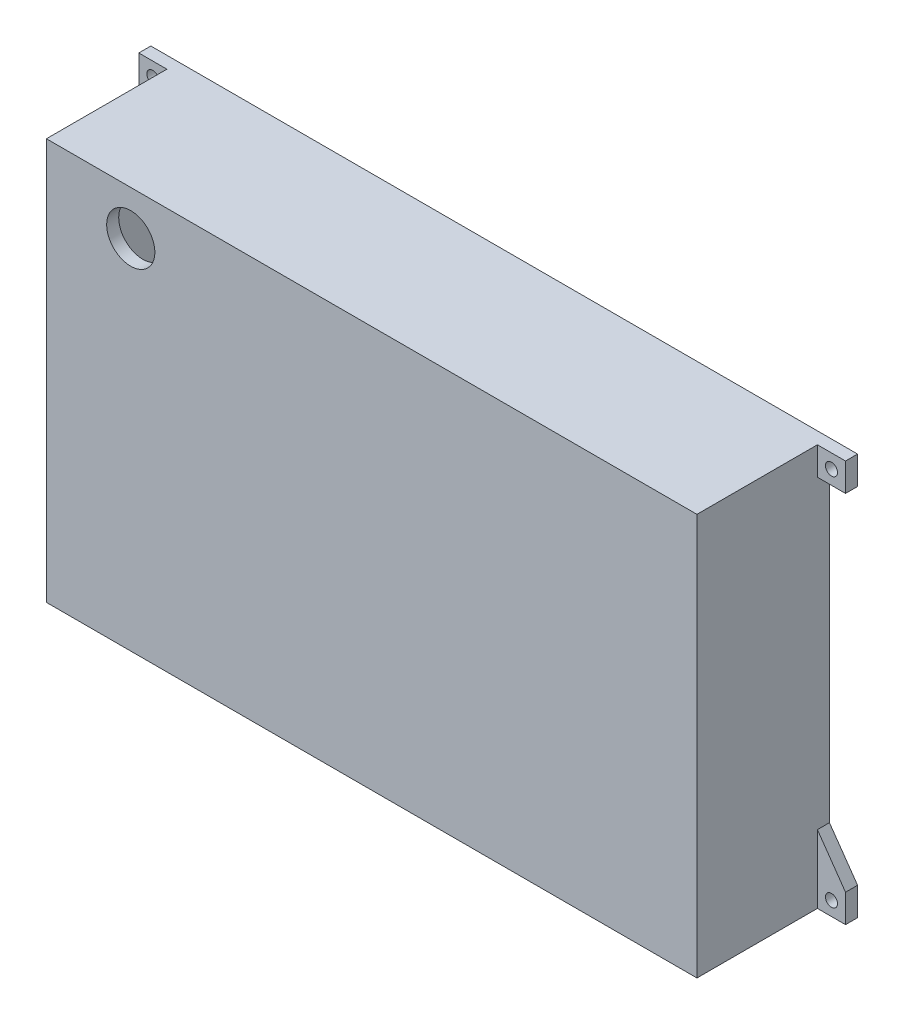
from build123d import *

# Parameters (mm, degrees)
BOSS_EXTRUDE1_DEPTH = 33
SKETCH1_4_W         = 7
SKETCH1_4_H         = 7
SKETCH1_4_R         = 1.5
BOSS_EXTRUDE2_DEPTH = 3
SKETCH3_W           = 156
SKETCH3_H           = 97
CUT_EXTRUDE1_DEPTH  = 30
SKETCH3_4_R         = 6
CUT_EXTRUDE2_DEPTH  = 33


with BuildPart() as part:
    # Sketch1 → Boss-Extrude1 (new body)
    with BuildSketch(Plane.XY):
        Polygon((162, 93), (162, 100), (0, 100), (0, 93), (0, 17), (0, 7), (0, 0), (162, 0), (162, 7), (162, 17), align=None)
    extrude(amount=BOSS_EXTRUDE1_DEPTH)

    # Sketch1<4> → Boss-Extrude2 (add)
    # profile 1 of 4: a face of its own
    with BuildSketch(Plane.XY):
        with Locations((165.5, 96.5)):
            Rectangle(SKETCH1_4_W, SKETCH1_4_H)
        with Locations((165.5, 96.5)):
            Circle(SKETCH1_4_R, mode=Mode.SUBTRACT)
    # profile 2 of 4: a face of its own
    with BuildSketch(Plane.XY):
        with Locations((-3.5, 96.5)):
            Rectangle(SKETCH1_4_W, SKETCH1_4_H)
        with Locations((-3.5, 96.5)):
            Circle(SKETCH1_4_R, mode=Mode.SUBTRACT)
    # profile 3 of 4: a face of its own
    with BuildSketch(Plane.XY):
        Polygon((169, 7), (162, 17), (162, 0), (169, 0), align=None)
        with Locations((165.5, 3.5)):
            Circle(SKETCH1_4_R, mode=Mode.SUBTRACT)
    # profile 4 of 4: a face of its own
    with BuildSketch(Plane.XY):
        Polygon((0, 0), (0, 17), (-7, 7), (-7, 0), align=None)
        with Locations((-3.5, 3.5)):
            Circle(SKETCH1_4_R, mode=Mode.SUBTRACT)
    extrude(amount=BOSS_EXTRUDE2_DEPTH)

    # Sketch3 → Cut-Extrude1 (cut)
    with BuildSketch(Plane(origin=(0, 0, 0), x_dir=(-1, 0, 0), z_dir=(0, 0, -1))):
        with Locations((-81, 48.5)):
            Rectangle(SKETCH3_W, SKETCH3_H)
    extrude(amount=-CUT_EXTRUDE1_DEPTH, mode=Mode.SUBTRACT)

    # Sketch3<4> → Cut-Extrude2 (cut)
    with BuildSketch(Plane(origin=(0, 0, 0), x_dir=(-1, 0, 0), z_dir=(0, 0, -1))):
        with Locations((-21, 89)):
            Circle(SKETCH3_4_R)
    extrude(amount=-CUT_EXTRUDE2_DEPTH, mode=Mode.SUBTRACT)


solid = part.part
